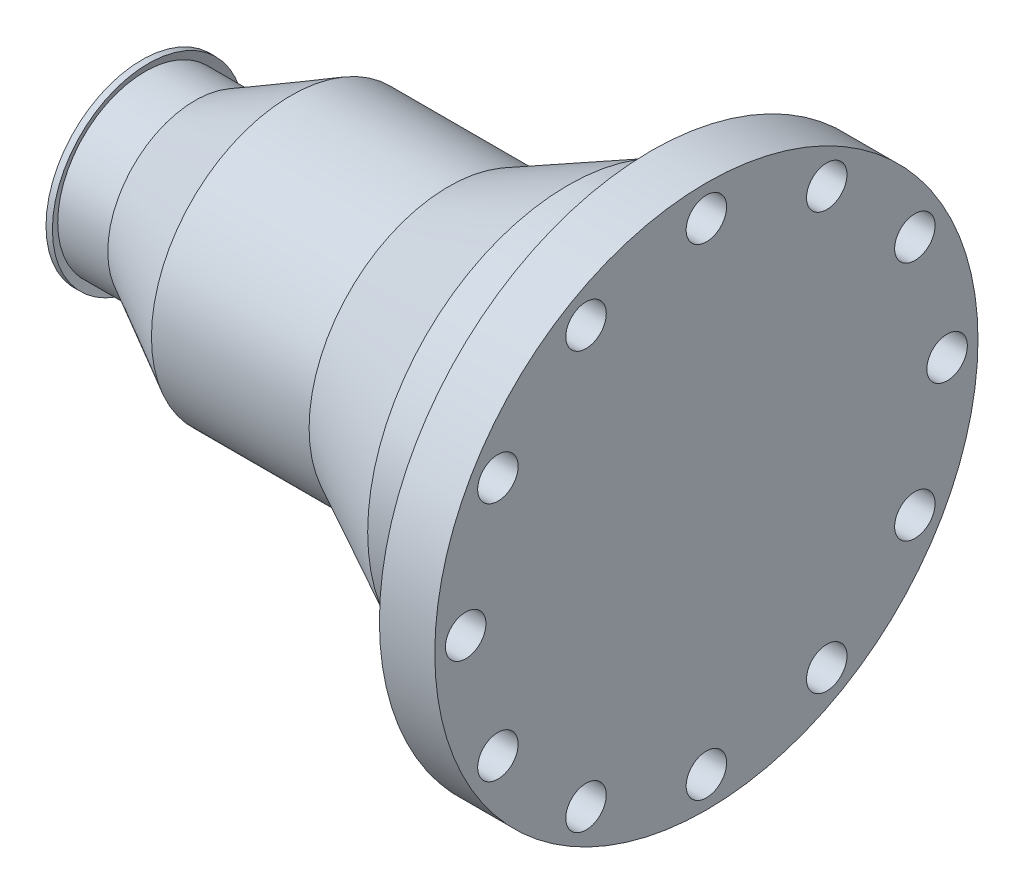
from build123d import *

# Parameters (mm, degrees)
SKETCH_3_R           = 9.5
CUT_EXTRUDE_1_DEPTH  = 321.526909947
SKETCH_4_R           = 9.5
CUT_EXTRUDE_2_DEPTH  = 321.526909947
SKETCH_5_R           = 9.5
CUT_EXTRUDE_3_DEPTH  = 321.526909947
SKETCH_6_R           = 9.5
CUT_EXTRUDE_4_DEPTH  = 321.526909947
SKETCH_7_R           = 9.5
CUT_EXTRUDE_5_DEPTH  = 321.526909947
SKETCH_8_R           = 9.5
CUT_EXTRUDE_6_DEPTH  = 321.526909947
SKETCH_9_R           = 9.5
CUT_EXTRUDE_7_DEPTH  = 321.526909947
SKETCH_10_R          = 9.5
CUT_EXTRUDE_8_DEPTH  = 321.526909947
SKETCH_11_R          = 9.5
CUT_EXTRUDE_9_DEPTH  = 321.526909947
SKETCH_12_R          = 9.5
CUT_EXTRUDE_10_DEPTH = 321.526909947
SKETCH_13_R          = 9.5
CUT_EXTRUDE_11_DEPTH = 321.526909947
SKETCH_14_R          = 9.5
CUT_EXTRUDE_12_DEPTH = 321.526909947


with BuildPart() as part:
    # Эскиз1 → Повернуть1 (revolve)
    with BuildSketch(Plane.XY, mode=Mode.PRIVATE) as revolve_1_sk:
        Polygon((0, 0), (265, 0), (265, 127.5), (239, 127.5), (239, 100), (239, 95), (220, 95), (220, 94), (200, 94), (144, 65.5), (70, 65.5), (25, 41), (1.5, 41), (3, 45), (0, 45), align=None)
    revolve(revolve_1_sk.sketch.rotate(Axis((0, 0, 0), (1, 0, 0)), 90), axis=Axis((0, 0, 0), (1, 0, 0)))

    # Эскиз2 → Вырез-Повернуть1 (revolve, cut)
    with BuildSketch(Plane.XY, mode=Mode.PRIVATE) as cut_revolve_1_sk:
        with BuildLine():
            Line((0, 0), (140, 0))
            Line((140, 0), (140, 52.583909796))
            Line((140, 52.583909796), (124.820646354, 52.583909796))
            ThreePointArc((124.820646354, 52.583909796), (118.294984956, 52.093441156), (111.880765, 50.796291))
            Line((111.880765, 50.796291), (38, 31))
            Line((38, 31), (0, 31))
            Line((0, 31), (0, 0))
        make_face()
    revolve(cut_revolve_1_sk.sketch.rotate(Axis((0, 0, 0), (1, 0, 0)), 90), axis=Axis((0, 0, 0), (1, 0, 0)), mode=Mode.SUBTRACT)

    # Эскиз3 → Вырез-Вытянуть1 (cut, through all)
    with BuildSketch(Plane(origin=(0, 0, 0), x_dir=(0, 0, -1), z_dir=(1, 0, 0))):
        with Locations((0, 113)):
            Circle(SKETCH_3_R)
    extrude(amount=CUT_EXTRUDE_1_DEPTH, mode=Mode.SUBTRACT)

    # Эскиз4 → Вырез-Вытянуть2 (cut, through all)
    with BuildSketch(Plane(origin=(0, 0, 0), x_dir=(0, 0, -1), z_dir=(1, 0, 0))):
        with Locations((-56.5, 97.860870628)):
            Circle(SKETCH_4_R)
    extrude(amount=CUT_EXTRUDE_2_DEPTH, mode=Mode.SUBTRACT)

    # Эскиз5 → Вырез-Вытянуть3 (cut, through all)
    with BuildSketch(Plane(origin=(0, 0, 0), x_dir=(0, 0, -1), z_dir=(1, 0, 0))):
        with Locations((-97.860870628, 56.5)):
            Circle(SKETCH_5_R)
    extrude(amount=CUT_EXTRUDE_3_DEPTH, mode=Mode.SUBTRACT)

    # Эскиз6 → Вырез-Вытянуть4 (cut, through all)
    with BuildSketch(Plane(origin=(0, 0, 0), x_dir=(0, 0, -1), z_dir=(1, 0, 0))):
        with Locations((-113, 0)):
            Circle(SKETCH_6_R)
    extrude(amount=CUT_EXTRUDE_4_DEPTH, mode=Mode.SUBTRACT)

    # Эскиз7 → Вырез-Вытянуть5 (cut, through all)
    with BuildSketch(Plane(origin=(0, 0, 0), x_dir=(0, 0, -1), z_dir=(1, 0, 0))):
        with Locations((-97.860870628, -56.5)):
            Circle(SKETCH_7_R)
    extrude(amount=CUT_EXTRUDE_5_DEPTH, mode=Mode.SUBTRACT)

    # Эскиз8 → Вырез-Вытянуть6 (cut, through all)
    with BuildSketch(Plane(origin=(0, 0, 0), x_dir=(0, 0, -1), z_dir=(1, 0, 0))):
        with Locations((-56.5, -97.860870628)):
            Circle(SKETCH_8_R)
    extrude(amount=CUT_EXTRUDE_6_DEPTH, mode=Mode.SUBTRACT)

    # Эскиз9 → Вырез-Вытянуть7 (cut, through all)
    with BuildSketch(Plane(origin=(0, 0, 0), x_dir=(0, 0, -1), z_dir=(1, 0, 0))):
        with Locations((0, -113)):
            Circle(SKETCH_9_R)
    extrude(amount=CUT_EXTRUDE_7_DEPTH, mode=Mode.SUBTRACT)

    # Эскиз10 → Вырез-Вытянуть8 (cut, through all)
    with BuildSketch(Plane(origin=(0, 0, 0), x_dir=(0, 0, -1), z_dir=(1, 0, 0))):
        with Locations((56.5, -97.860870628)):
            Circle(SKETCH_10_R)
    extrude(amount=CUT_EXTRUDE_8_DEPTH, mode=Mode.SUBTRACT)

    # Эскиз11 → Вырез-Вытянуть9 (cut, through all)
    with BuildSketch(Plane(origin=(0, 0, 0), x_dir=(0, 0, -1), z_dir=(1, 0, 0))):
        with Locations((97.860870628, -56.5)):
            Circle(SKETCH_11_R)
    extrude(amount=CUT_EXTRUDE_9_DEPTH, mode=Mode.SUBTRACT)

    # Эскиз12 → Вырез-Вытянуть10 (cut, through all)
    with BuildSketch(Plane(origin=(0, 0, 0), x_dir=(0, 0, -1), z_dir=(1, 0, 0))):
        with Locations((113, 0)):
            Circle(SKETCH_12_R)
    extrude(amount=CUT_EXTRUDE_10_DEPTH, mode=Mode.SUBTRACT)

    # Эскиз13 → Вырез-Вытянуть11 (cut, through all)
    with BuildSketch(Plane(origin=(0, 0, 0), x_dir=(0, 0, -1), z_dir=(1, 0, 0))):
        with Locations((97.860870628, 56.5)):
            Circle(SKETCH_13_R)
    extrude(amount=CUT_EXTRUDE_11_DEPTH, mode=Mode.SUBTRACT)

    # Эскиз14 → Вырез-Вытянуть12 (cut, through all)
    with BuildSketch(Plane(origin=(0, 0, 0), x_dir=(0, 0, -1), z_dir=(1, 0, 0))):
        with Locations((56.5, 97.860870628)):
            Circle(SKETCH_14_R)
    extrude(amount=CUT_EXTRUDE_12_DEPTH, mode=Mode.SUBTRACT)


solid = part.part
